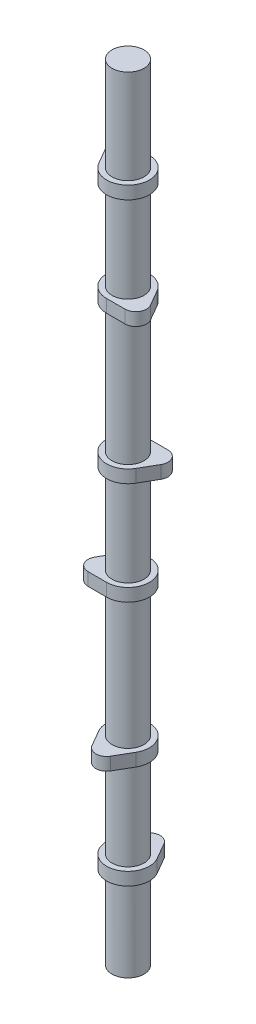
from build123d import *

# Parameters (mm, degrees)
BOSS_EXTRUDE1_DEPTH   = 3.81
BODY_MOVE_COPY2_ANGLE = 180
BOSS_EXTRUDE2_START   = -25.4
SKETCH2_R             = 9.5
BOSS_EXTRUDE2_DEPTH   = 146.05
LPATTERN1_COUNT       = 3
LPATTERN1_PITCH       = 146.05
BODY_MOVE_COPY3_ANGLE = 120
BODY_MOVE_COPY4_ANGLE = 120
BOSS_EXTRUDE3_START   = 27.94
SKETCH4_R             = 9.5
BOSS_EXTRUDE3_DEPTH   = 27.94


with BuildPart() as part:
    # Sketch1 → Boss-Extrude1 (new, symmetric)
    with BuildSketch(Plane(origin=(0, 0, 0), x_dir=(1, 0, 0), z_dir=(0, 1, 0))):
        with BuildLine():
            Line((-10.998522628, 6.35), (-5.499261314, 15.875))
            ThreePointArc((-5.499261314, 15.875), (0, 19.05), (5.499261314, 15.875))
            Line((5.499261314, 15.875), (10.998522628, 6.35))
            ThreePointArc((10.998522628, 6.35), (0, -12.7), (-10.998522628, 6.35))
        make_face()
    extrude(amount=BOSS_EXTRUDE1_DEPTH, both=True)


with BuildPart() as body_2:
    # Body-Move/Copy1: copy of part
    add(part.part.moved(Location((0, 60.96, 0))))


with BuildPart() as body_2_1:
    # Body-Move/Copy2: moved
    add(body_2.part.rotate(Axis((0, 0, 0), (0, 1, 0)), BODY_MOVE_COPY2_ANGLE))


with BuildPart() as part_1:
    add(part.part)

    add(body_2_1.part)  # Boss-Extrude2 merges body 2
    # Sketch2 → Boss-Extrude2 (add)
    with BuildSketch(Plane(origin=(0, 0, 0), x_dir=(1, 0, 0), z_dir=(0, 1, 0)).offset(BOSS_EXTRUDE2_START)):
        Circle(SKETCH2_R)
    extrude(amount=BOSS_EXTRUDE2_DEPTH)


with BuildPart() as lpattern1_1:
    # LPattern1: pattern copy
    add(part_1.part.moved(Location(Vector(0, 1, 0) * (1 * LPATTERN1_PITCH))))


with BuildPart() as lpattern1_2:
    # LPattern1: pattern copy
    add(part_1.part.moved(Location(Vector(0, 1, 0) * (2 * LPATTERN1_PITCH))))


with BuildPart() as lpattern1_1_1:
    # Body-Move/Copy3: moved
    add(lpattern1_1.part.rotate(Axis((0, 0, 0), (0, 1, 0)), BODY_MOVE_COPY3_ANGLE))


with BuildPart() as lpattern1_2_1:
    # Body-Move/Copy4: moved
    add(lpattern1_2.part.rotate(Axis((0, 0, 0), (0, -1, 0)), BODY_MOVE_COPY4_ANGLE))


with BuildPart() as part_2:
    add(part_1.part)

    # Sketch4 → Boss-Extrude3 (add)
    with BuildSketch(Plane.XZ.offset(25.4).offset(BOSS_EXTRUDE3_START)):
        Circle(SKETCH4_R)
    extrude(amount=-BOSS_EXTRUDE3_DEPTH)


with BuildPart() as lpattern1_2_2:
    add(lpattern1_2_1.part)

    # Combine1: union LPattern1_1, part
    add(lpattern1_1_1.part)
    add(part_2.part)


solid = lpattern1_2_2.part
